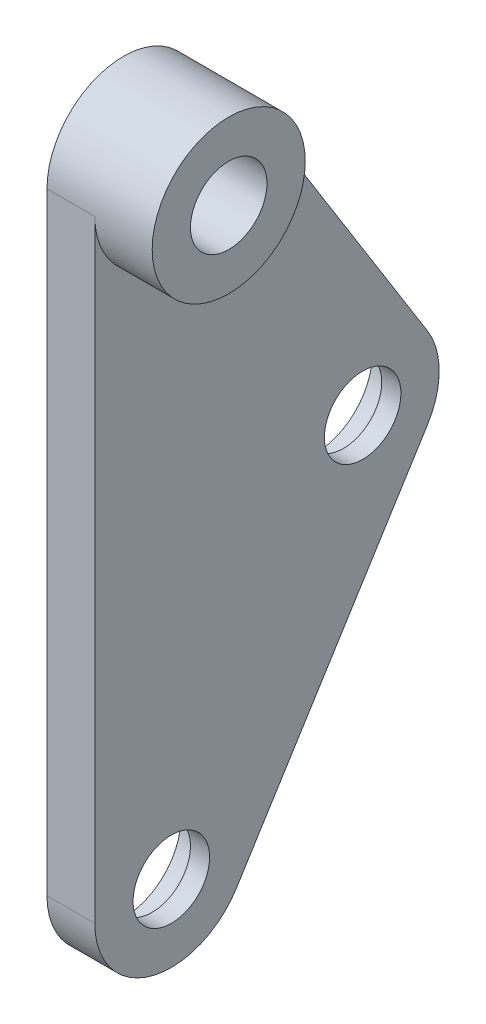
from build123d import *

# Parameters (mm, degrees)
EXTRUDE_1_DEPTH          = 2.5
EXTRUDE_START            = 2.5
SKETCH_1_4_R             = 4
EXTRUDE_2_DEPTH          = 3
CUT_EXTRUDE_1_DEPTH      = 45.206899914
CUT_EXTRUDE_1_DEPTH_BACK = 45.206899914
SKETCH_1_3_R             = 2
SKETCH_2_R               = 3
CUT_EXTRUDE_2_DEPTH      = 1.5


with BuildPart() as part:
    # 草图1 → 凸台-拉伸1 (new body)
    with BuildSketch(Plane(origin=(0, 0, 0), x_dir=(0, 0, -1), z_dir=(1, 0, 0))):
        with BuildLine():
            Line((17.391993216, -17.88000424), (7.391993216, -1.88000424))
            ThreePointArc((7.391993216, -1.88000424), (2.897269948, -0.155005015), (0, -4))
            Line((0, -4), (0, -36))
            ThreePointArc((0, -36), (2.897269948, -39.844994985), (7.391993216, -38.11999576))
            Line((7.391993216, -38.11999576), (17.391993216, -22.11999576))
            ThreePointArc((17.391993216, -22.11999576), (18, -20), (17.391993216, -17.88000424))
        make_face()
    extrude(amount=EXTRUDE_1_DEPTH)

    # 草图1<4> → 凸台-拉伸2 (add)
    with BuildSketch(Plane(origin=(0, 0, 0), x_dir=(0, 0, -1), z_dir=(1, 0, 0)).offset(EXTRUDE_START)):
        with Locations(Location((4, -4, 0), (0, 0, 180))):
            Circle(SKETCH_1_4_R)
    extrude(amount=EXTRUDE_2_DEPTH)

    # 草图1<3> → 切除-拉伸1 (cut, two sides: drawn at the far end of the back side and taken through both)
    with BuildSketch(Plane(origin=(0, 0, 0), x_dir=(0, 0, -1), z_dir=(1, 0, 0)).offset(-CUT_EXTRUDE_1_DEPTH_BACK)):
        with Locations((4, -4)):
            Circle(SKETCH_1_3_R)
        with Locations((14, -20)):
            Circle(SKETCH_1_3_R)
        with Locations((4, -36)):
            Circle(SKETCH_1_3_R)
    extrude(amount=CUT_EXTRUDE_1_DEPTH + CUT_EXTRUDE_1_DEPTH_BACK, mode=Mode.SUBTRACT)

    # 草图2 → 切除-拉伸2 (cut)
    with BuildSketch(Plane.ZY):
        with Locations((-4, -4)):
            Circle(SKETCH_2_R)
        with Locations((-14, -20)):
            Circle(SKETCH_2_R)
        with Locations((-4, -36)):
            Circle(SKETCH_2_R)
    extrude(amount=-CUT_EXTRUDE_2_DEPTH, mode=Mode.SUBTRACT)


solid = part.part
